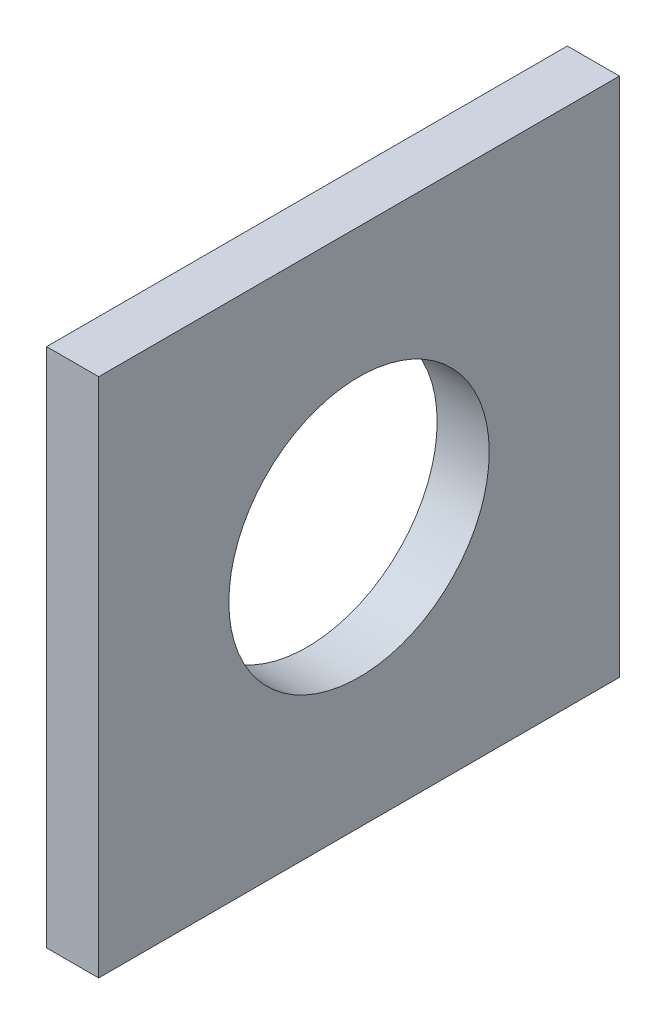
from build123d import *

# Parameters (mm, degrees)
SKETCH1_W           = 20
SKETCH1_H           = 20
BOSS_EXTRUDE1_DEPTH = 2
SKETCH2_R           = 5
CUT_EXTRUDE1_DEPTH  = 29.354893758


with BuildPart() as part:
    # Sketch1 → Boss-Extrude1 (new body)
    with BuildSketch(Plane(origin=(0, 0, 0), x_dir=(0, 0, -1), z_dir=(1, 0, 0))):
        with Locations((10, 10)):
            Rectangle(SKETCH1_W, SKETCH1_H)
    extrude(amount=BOSS_EXTRUDE1_DEPTH)

    # Sketch2 → Cut-Extrude1 (cut, through all)
    with BuildSketch(Plane(origin=(2, 0, 0), x_dir=(0, 0, -1), z_dir=(1, 0, 0))):
        with Locations((10, 10)):
            Circle(SKETCH2_R)
    extrude(amount=-CUT_EXTRUDE1_DEPTH, mode=Mode.SUBTRACT)


solid = part.part
